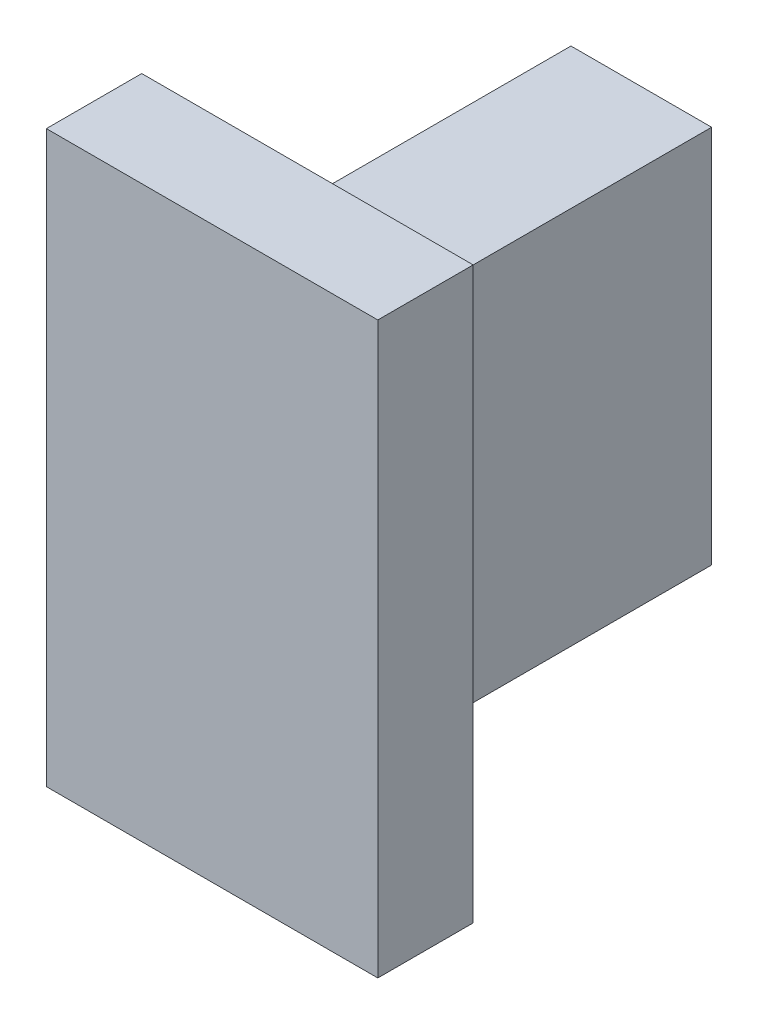
from build123d import *

# Parameters (mm, degrees)
SKETCH1_W           = 2.95
SKETCH1_H           = 7.95
BOSS_EXTRUDE1_DEPTH = 8
SHELL1_T            = -0.5
SKETCH2_W           = 4.95
SKETCH2_H           = 9.95
BOSS_EXTRUDE2_DEPTH = 1
SKETCH3_W           = 1.95
SKETCH3_H           = 0.3
BOSS_EXTRUDE3_DEPTH = 7.5
SKETCH4_W           = 6.95
SKETCH4_H           = 11.95
SKETCH4_W_2         = 4.95
SKETCH4_H_2         = 9.95
BOSS_EXTRUDE5_DEPTH = 2


with BuildPart() as part:
    # Sketch1 → Boss-Extrude1 (new body)
    with BuildSketch(Plane.XY):
        with Locations((0.443379447, -2.741798419)):
            Rectangle(SKETCH1_W, SKETCH1_H)
    extrude(amount=BOSS_EXTRUDE1_DEPTH)

    # Shell1
    shell1_openings = [part.faces().sort_by_distance(p)[0] for p in [
        (0.443379447, -2.741798419, 0),
    ]]
    offset(amount=SHELL1_T, openings=shell1_openings, kind=Kind.INTERSECTION)

    # Sketch2 → Boss-Extrude2 (add)
    with BuildSketch(Plane.XY.offset(8)):
        with Locations((0.443379447, -2.741798419)):
            Rectangle(SKETCH2_W, SKETCH2_H)
    extrude(amount=BOSS_EXTRUDE2_DEPTH)

    # Sketch3 → Boss-Extrude3 (add)
    with BuildSketch(Plane(origin=(0, 0, 7.5), x_dir=(-1, 0, 0), z_dir=(0, 0, -1))):
        with Locations((-0.443379447, -0.854298419)):
            Rectangle(SKETCH3_W, SKETCH3_H)
        with Locations((-0.443379447, -2.594298419)):
            Rectangle(SKETCH3_W, SKETCH3_H)
        with Locations((-0.443379447, -4.334298419)):
            Rectangle(SKETCH3_W, SKETCH3_H)
    extrude(amount=BOSS_EXTRUDE3_DEPTH)

    # Sketch4 → Boss-Extrude5 (add)
    with BuildSketch(Plane.XY.offset(9)):
        with Locations((0.443379447, -2.741798419)):
            Rectangle(SKETCH4_W, SKETCH4_H)
        with Locations((0.443379447, -2.741798419)):
            Rectangle(SKETCH4_W_2, SKETCH4_H_2, mode=Mode.SUBTRACT)
    extrude(amount=-BOSS_EXTRUDE5_DEPTH)


solid = part.part
